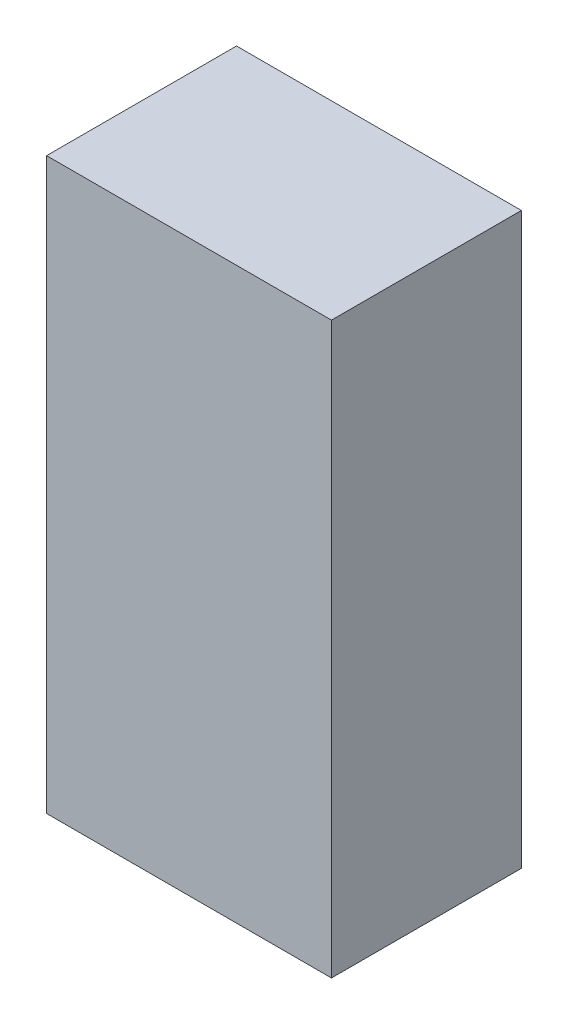
from build123d import *

# Parameters (mm, degrees)
SKETCH1_W           = 30
SKETCH1_H           = 60
BOSS_EXTRUDE1_DEPTH = 20
SCALE1_SCALE        = 0.001


with BuildPart() as part:
    # Sketch1 → Boss-Extrude1 (new body)
    with BuildSketch(Plane.XY):
        Rectangle(SKETCH1_W, SKETCH1_H)
    extrude(amount=BOSS_EXTRUDE1_DEPTH)


with BuildPart() as part_1:
    # Scale1: scaled about (0, 0, 10)
    add(part.part.scale(SCALE1_SCALE).moved(Location((0, 0, 9.99))))


solid = part_1.part
